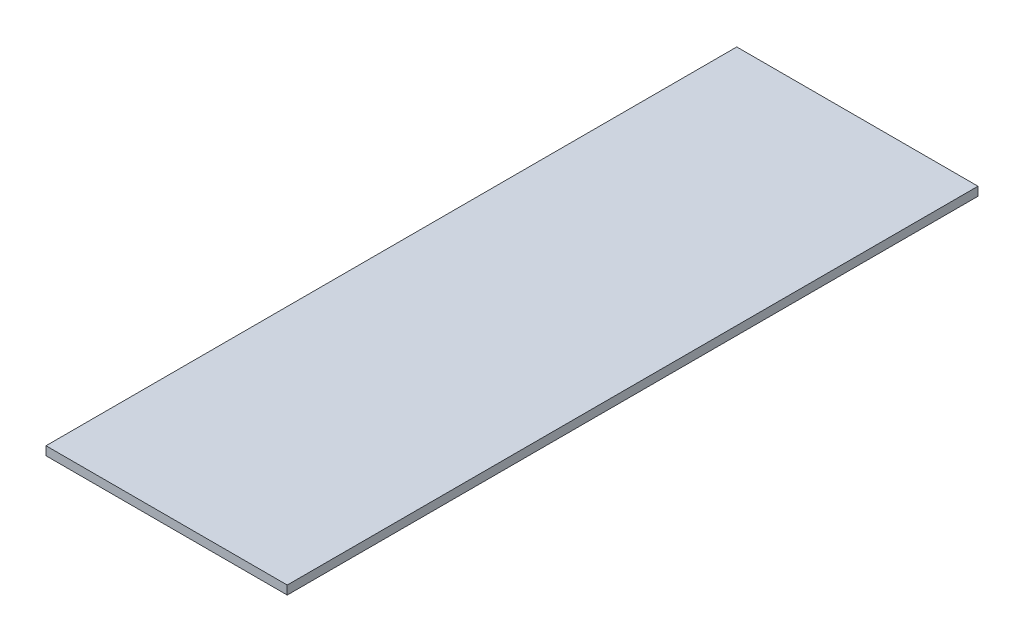
from build123d import *

# Parameters (mm, degrees)
ESQUISSE1_W        = 41.210599086
ESQUISSE1_H        = 1.486783871
BOSS_EXTRU_1_DEPTH = 118


with BuildPart() as part:
    # Esquisse1 → Boss.-Extru.1 (new body)
    with BuildSketch(Plane.XY):
        with Locations((0.477352141, -6.603371288)):
            Rectangle(ESQUISSE1_W, ESQUISSE1_H)
    extrude(amount=BOSS_EXTRU_1_DEPTH)


solid = part.part
